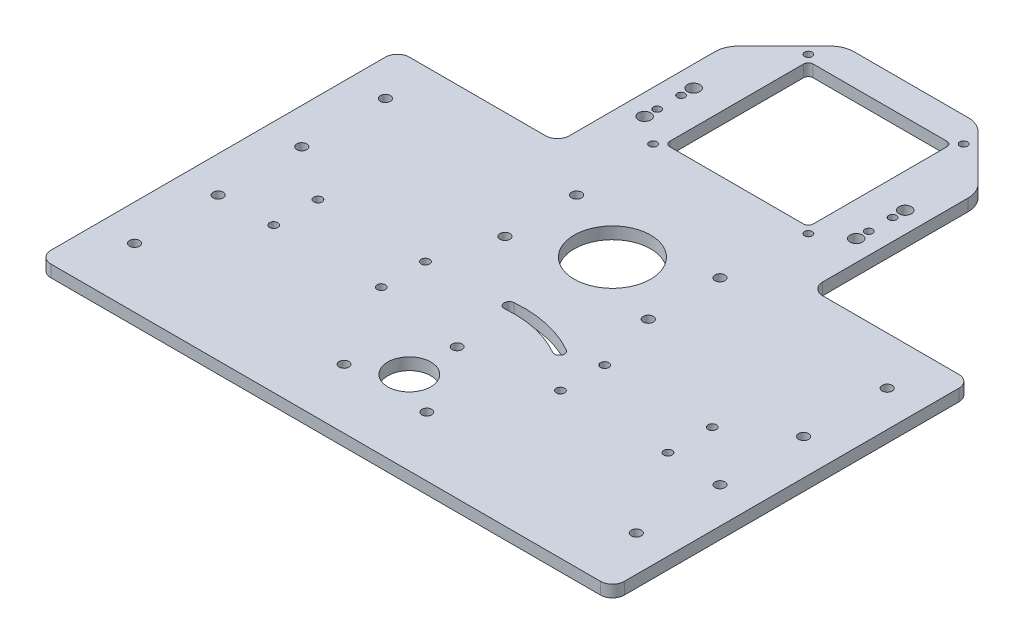
from build123d import *

# Parameters (mm, degrees)
SKETCH_1_W          = 240
SKETCH_1_H          = 65
SKETCH_1_R          = 2.1
SKETCH_1_R_2        = 16
EXTRUDE_1_DEPTH     = 5
SKETCH_2_W          = 240
SKETCH_2_H          = 75
SKETCH_2_R          = 2.05
SKETCH_2_R_2        = 9
SKETCH_2_R_3        = 2.1
SKETCH_2_W_2        = 106
SKETCH_2_H_2        = 105
SKETCH_2_R_4        = 2.6
SKETCH_2_R_5        = 1.6
EXTRUDE_2_DEPTH     = 5
CUT_EXTRUDE_1_DEPTH = 10
SKETCH_4_W          = 240
SKETCH_4_H          = 10
EXTRUDE_3_DEPTH     = 5
FILLET_5_R          = 5
SKETCH_6_R          = 1.6
SKETCH_6_W          = 60
SKETCH_6_H          = 60
CUT_EXTRUDE_2_DEPTH = 10
FILLET_6_R          = 5
CHAMFER_1_SIZE      = 25
SKETCH_7_R          = 1.75
CUT_EXTRUDE_3_DEPTH = 10
FILLET_7_R          = 10
FILLET_8_R          = 2


with BuildPart() as part:
    # 草图1 → 凸台-拉伸1 (new body)
    with BuildSketch(Plane(origin=(0, 0, 0), x_dir=(1, 0, 0), z_dir=(0, 1, 0))):
        Rectangle(SKETCH_1_W, SKETCH_1_H)
        with Locations(Location((-105, 22.5, 0), (0, 0, 270))):
            Circle(SKETCH_1_R, mode=Mode.SUBTRACT)
        with Locations(Location((-105, -12.5, 0), (0, 0, 270))):
            Circle(SKETCH_1_R, mode=Mode.SUBTRACT)
        with Locations(Location((105, -12.5, 0), (0, 0, 90))):
            Circle(SKETCH_1_R, mode=Mode.SUBTRACT)
        with Locations(Location((105, 22.5, 0), (0, 0, 90))):
            Circle(SKETCH_1_R, mode=Mode.SUBTRACT)
        with Locations(Location((0, 12.5, 0), (0, 0, 270))):
            Circle(SKETCH_1_R_2, mode=Mode.SUBTRACT)
        with Locations(Location((-30, 27.5, 0), (0, 0, 270))):
            Circle(SKETCH_1_R, mode=Mode.SUBTRACT)
        with Locations(Location((30, 27.5, 0), (0, 0, 270))):
            Circle(SKETCH_1_R, mode=Mode.SUBTRACT)
        with Locations(Location((30, -2.5, 0), (0, 0, 90))):
            Circle(SKETCH_1_R, mode=Mode.SUBTRACT)
        with Locations(Location((-30, -2.5, 0), (0, 0, 90))):
            Circle(SKETCH_1_R, mode=Mode.SUBTRACT)
    extrude(amount=EXTRUDE_1_DEPTH)

    # 草图2 → 凸台-拉伸2 (add)
    # profile 1 of 2: a face of its own
    with BuildSketch(Plane(origin=(0, 5, 0), x_dir=(1, 0, 0), z_dir=(0, 1, 0))):
        with Locations((0, -70)):
            Rectangle(SKETCH_2_W, SKETCH_2_H)
        with Locations(Location((17.320508076, -82.5, 0), (0, 0, 270))):
            Circle(SKETCH_2_R, mode=Mode.SUBTRACT)
        with Locations(Location((0, -72.5, 0), (0, 0, 270))):
            Circle(SKETCH_2_R_2, mode=Mode.SUBTRACT)
        with Locations(Location((-17.320508076, -82.5, 0), (0, 0, 270))):
            Circle(SKETCH_2_R, mode=Mode.SUBTRACT)
        with Locations(Location((0, -52.5, 0), (0, 0, 270))):
            Circle(SKETCH_2_R, mode=Mode.SUBTRACT)
        with Locations(Location((-105, -47.5, 0), (0, 0, 270))):
            Circle(SKETCH_2_R_3, mode=Mode.SUBTRACT)
        with Locations(Location((-105, -82.5, 0), (0, 0, 270))):
            Circle(SKETCH_2_R_3, mode=Mode.SUBTRACT)
        with Locations(Location((105, -47.5, 0), (0, 0, 270))):
            Circle(SKETCH_2_R_3, mode=Mode.SUBTRACT)
        with Locations(Location((105, -82.5, 0), (0, 0, 270))):
            Circle(SKETCH_2_R_3, mode=Mode.SUBTRACT)
    # profile 2 of 2: a face of its own
    with BuildSketch(Plane(origin=(0, 5, 0), x_dir=(1, 0, 0), z_dir=(0, 1, 0))):
        with Locations((0, 85)):
            Rectangle(SKETCH_2_W_2, SKETCH_2_H_2)
        with Locations(Location((-44.270509831, 70.25, 0), (0, 0, 270))):
            Circle(SKETCH_2_R_4, mode=Mode.SUBTRACT)
        with Locations(Location((-44.270509831, 75.5, 0), (0, 0, 270))):
            Circle(SKETCH_2_R_5, mode=Mode.SUBTRACT)
        with Locations(Location((-44.270509831, 85.5, 0), (0, 0, 270))):
            Circle(SKETCH_2_R_5, mode=Mode.SUBTRACT)
        with Locations(Location((-44.270509831, 90.75, 0), (0, 0, 270))):
            Circle(SKETCH_2_R_4, mode=Mode.SUBTRACT)
        with Locations(Location((44.270509831, 70.25, 0), (0, 0, 270))):
            Circle(SKETCH_2_R_4, mode=Mode.SUBTRACT)
        with Locations(Location((44.270509831, 75.5, 0), (0, 0, 270))):
            Circle(SKETCH_2_R_5, mode=Mode.SUBTRACT)
        with Locations(Location((44.270509831, 85.5, 0), (0, 0, 270))):
            Circle(SKETCH_2_R_5, mode=Mode.SUBTRACT)
        with Locations(Location((44.270509831, 90.75, 0), (0, 0, 270))):
            Circle(SKETCH_2_R_4, mode=Mode.SUBTRACT)
    extrude(amount=-EXTRUDE_2_DEPTH)

    # 草图3 → 切除-拉伸1 (cut)
    with BuildSketch(Plane(origin=(0, 5, 0), x_dir=(1, 0, 0), z_dir=(0, 1, 0))):
        with BuildLine():
            ThreePointArc((24.05, -30.844178078), (10.41074543, -25.540162058), (-4.192191226, -24.583035022))
            ThreePointArc((-4.192191226, -24.583035022), (-6.101173032, -26.858070948), (-3.826137107, -28.767052754))
            ThreePointArc((-3.826137107, -28.767052754), (9.501699052, -29.640605287), (21.95, -34.481484774))
            ThreePointArc((21.95, -34.481484774), (24.818653348, -33.712831426), (24.05, -30.844178078))
        make_face()
    extrude(amount=-CUT_EXTRUDE_1_DEPTH, mode=Mode.SUBTRACT)

    # 草图4 → 凸台-拉伸3 (add)
    with BuildSketch(Plane(origin=(0, 5, 0), x_dir=(1, 0, 0), z_dir=(0, 1, 0))):
        with Locations((0, 37.5)):
            Rectangle(SKETCH_4_W, SKETCH_4_H)
    extrude(amount=-EXTRUDE_3_DEPTH)

    # 圆角5
    fillet_5_edges = [part.edges().sort_by_distance(p)[0] for p in [
        (-120, 2.5, -42.5),
        (120, 2.5, -42.5),
        (-120, 2.5, 107.5),
        (120, 2.5, 107.5),
    ]]
    fillet(fillet_5_edges, radius=FILLET_5_R)

    # 草图6 → 切除-拉伸2 (cut)
    with BuildSketch(Plane.XZ):
        with Locations(Location((-32.5, -62, 0), (0, 0, 270))):
            Circle(SKETCH_6_R)
        with Locations(Location((32.5, -62, 0), (0, 0, 270))):
            Circle(SKETCH_6_R)
        with Locations(Location((32.5, -127, 0), (0, 0, 90))):
            Circle(SKETCH_6_R)
        with Locations(Location((-32.5, -127, 0), (0, 0, 90))):
            Circle(SKETCH_6_R)
        with Locations((0, -94.5)):
            Rectangle(SKETCH_6_W, SKETCH_6_H)
    extrude(amount=-CUT_EXTRUDE_2_DEPTH, mode=Mode.SUBTRACT)

    # 圆角6
    fillet_6_edges = [part.edges().sort_by_distance(p)[0] for p in [
        (-53, 2.5, -42.5),
        (53, 2.5, -42.5),
    ]]
    fillet(fillet_6_edges, radius=FILLET_6_R)

    # 倒角1
    chamfer_1_edges = [part.edges().sort_by_distance(p)[0] for p in [
        (53, 2.5, -137.5),
        (-53, 2.5, -137.5),
    ]]
    chamfer(chamfer_1_edges, length=CHAMFER_1_SIZE)

    # 草图7 → 切除-拉伸3 (cut)
    with BuildSketch(Plane(origin=(0, 5, 0), x_dir=(1, 0, 0), z_dir=(0, 1, 0))):
        with Locations(Location((37.5, -28.25, 0), (0, 0, 270))):
            Circle(SKETCH_7_R)
        with Locations(Location((37.5, -46.75, 0), (0, 0, 270))):
            Circle(SKETCH_7_R)
        with Locations(Location((82.5, -28.25, 0), (0, 0, 270))):
            Circle(SKETCH_7_R)
        with Locations(Location((82.5, -46.75, 0), (0, 0, 270))):
            Circle(SKETCH_7_R)
        with Locations(Location((-82.5, -46.75, 0), (0, 0, 270))):
            Circle(SKETCH_7_R)
        with Locations(Location((-82.5, -28.25, 0), (0, 0, 270))):
            Circle(SKETCH_7_R)
        with Locations(Location((-37.5, -46.75, 0), (0, 0, 270))):
            Circle(SKETCH_7_R)
        with Locations(Location((-37.5, -28.25, 0), (0, 0, 270))):
            Circle(SKETCH_7_R)
    extrude(amount=-CUT_EXTRUDE_3_DEPTH, mode=Mode.SUBTRACT)

    # 圆角7
    fillet_7_edges = [part.edges().sort_by_distance(p)[0] for p in [
        (53, 2.5, -112.5),
        (-28, 2.5, -137.5),
        (28, 2.5, -137.5),
        (-53, 2.5, -112.5),
    ]]
    fillet(fillet_7_edges, radius=FILLET_7_R)

    # 圆角8
    fillet_8_edges = [part.edges().sort_by_distance(p)[0] for p in [
        (30, 2.5, -64.5),
        (30, 2.5, -124.5),
        (-30, 2.5, -124.5),
        (-30, 2.5, -64.5),
    ]]
    fillet(fillet_8_edges, radius=FILLET_8_R)


solid = part.part
